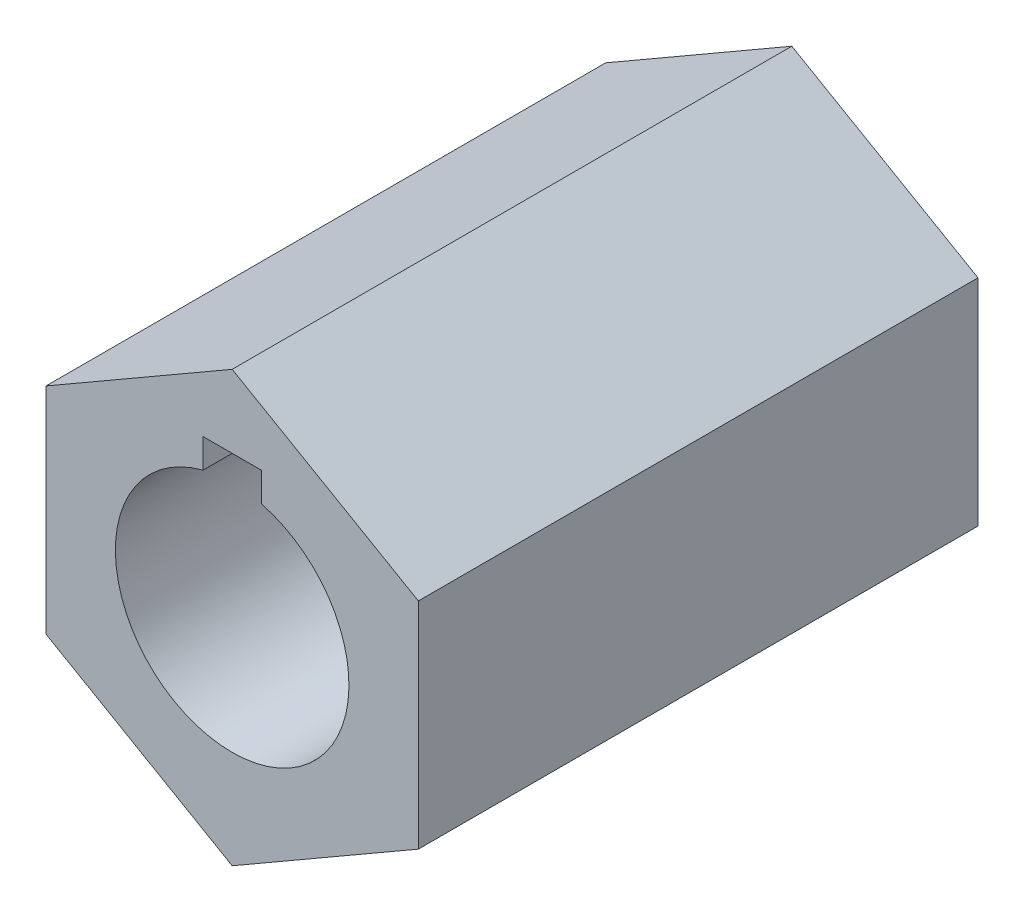
from build123d import *

# Parameters (mm, degrees)
BOSS_EXTRUDE1_DEPTH = 19.05


with BuildPart() as part:
    # Sketch1 → Boss-Extrude1 (new body)
    with BuildSketch(Plane.XY):
        Polygon((6.3373, 3.658841861), (0, 7.317683722), (-6.3373, 3.658841861), (-6.3373, -3.658841861), (0, -7.317683722), (6.3373, -3.658841861), align=None)
        with BuildLine():
            ThreePointArc((3.9751, 0), (-2.435537513, -3.141588298), (-0.9906, 3.84969241))
            Line((-0.9906, 3.84969241), (-0.9906, 4.84029241))
            Line((-0.9906, 4.84029241), (0.9906, 4.84029241))
            Line((0.9906, 4.84029241), (0.9906, 3.84969241))
            ThreePointArc((0.9906, 3.84969241), (3.141588298, 2.435537513), (3.9751, 0))
        make_face(mode=Mode.SUBTRACT)
    extrude(amount=BOSS_EXTRUDE1_DEPTH)


solid = part.part
